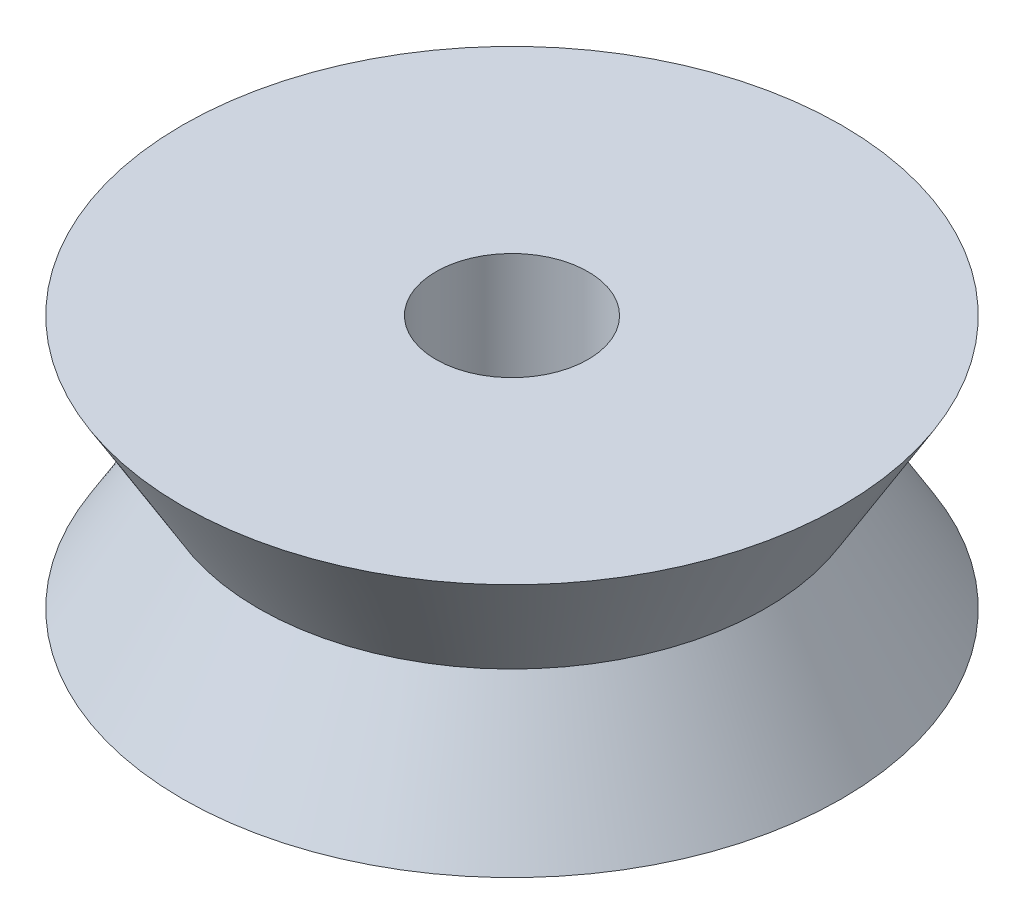
from build123d import *


with BuildPart() as part:
    # Croquis1 → Revolución1 (revolve)
    with BuildSketch(Plane.XY, mode=Mode.PRIVATE) as revoluci_n1_sk:
        Polygon((3, -5), (3, 5), (13, 5), (10, 0), (13, -5), align=None)
    revolve(revoluci_n1_sk.sketch.rotate(Axis((0, 5.5, 0), (0, -1, 0)), 90), axis=Axis((0, 5.5, 0), (0, -1, 0)))


solid = part.part
